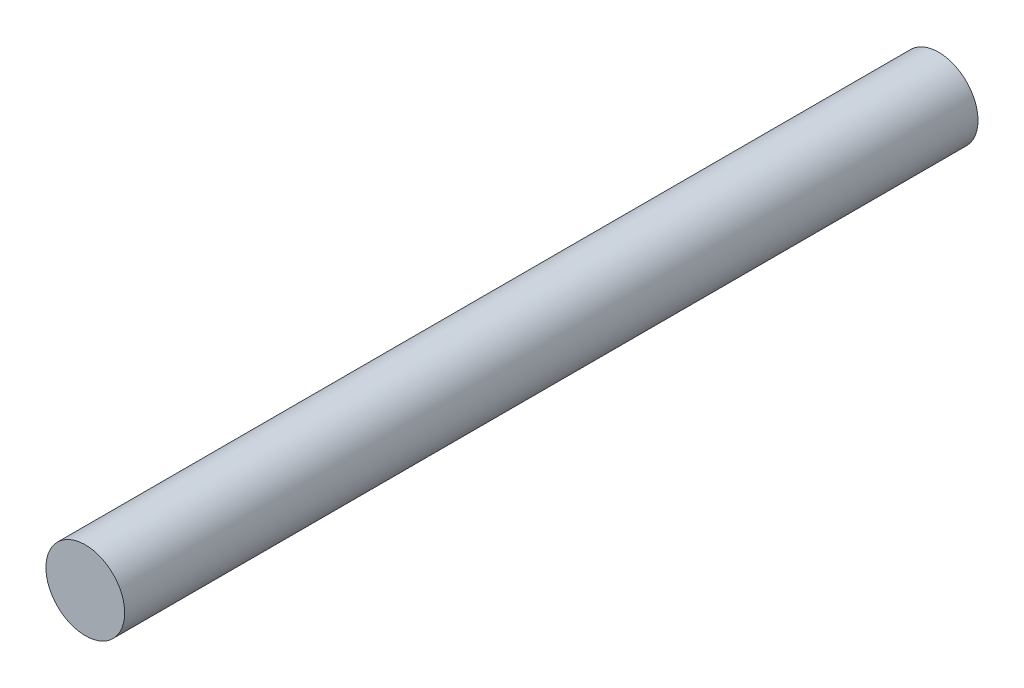
from build123d import *

# Parameters (mm, degrees)
SKETCH_1_R      = 3
EXTRUDE_1_DEPTH = 65


with BuildPart() as part:
    # 草图1 → 凸台-拉伸1 (new body)
    with BuildSketch(Plane.XY):
        Circle(SKETCH_1_R)
    extrude(amount=EXTRUDE_1_DEPTH)


solid = part.part
